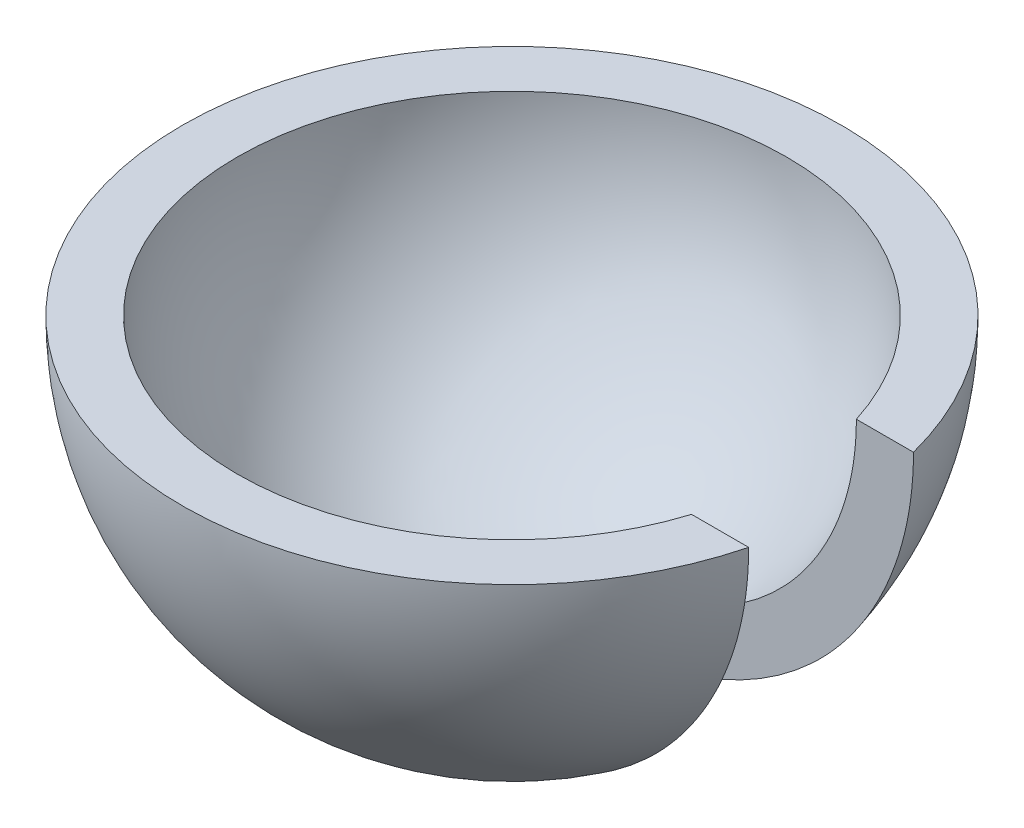
from build123d import *

# Parameters (mm, degrees)
REVOLVE1_ANGLE     = 180
SKETCH2_W          = 6
SKETCH2_H          = 3
CUT_EXTRUDE1_DEPTH = 11.392304845


with BuildPart() as part:
    # Sketch1 → Revolve1 (revolve)
    with BuildSketch(Plane(origin=(0, 0, 0), x_dir=(1, 0, 0), z_dir=(0, 1, 0))):
        with BuildLine():
            Line((-5, 0), (-6, 0))
            ThreePointArc((-6, 0), (0, 6), (6, 0))
            Line((6, 0), (5, 0))
            ThreePointArc((5, 0), (0, 5), (-5, 0))
        make_face()
    revolve(axis=Axis((-5, 0, 0), (-1, 0, 0)), revolution_arc=REVOLVE1_ANGLE)

    # Sketch2 → Cut-Extrude1 (cut, through all)
    with BuildSketch(Plane(origin=(0, 0, 0), x_dir=(1, 0, 0), z_dir=(0, 1, 0))):
        with Locations((3, 0)):
            Rectangle(SKETCH2_W, SKETCH2_H)
    extrude(amount=-CUT_EXTRUDE1_DEPTH, mode=Mode.SUBTRACT)


solid = part.part
